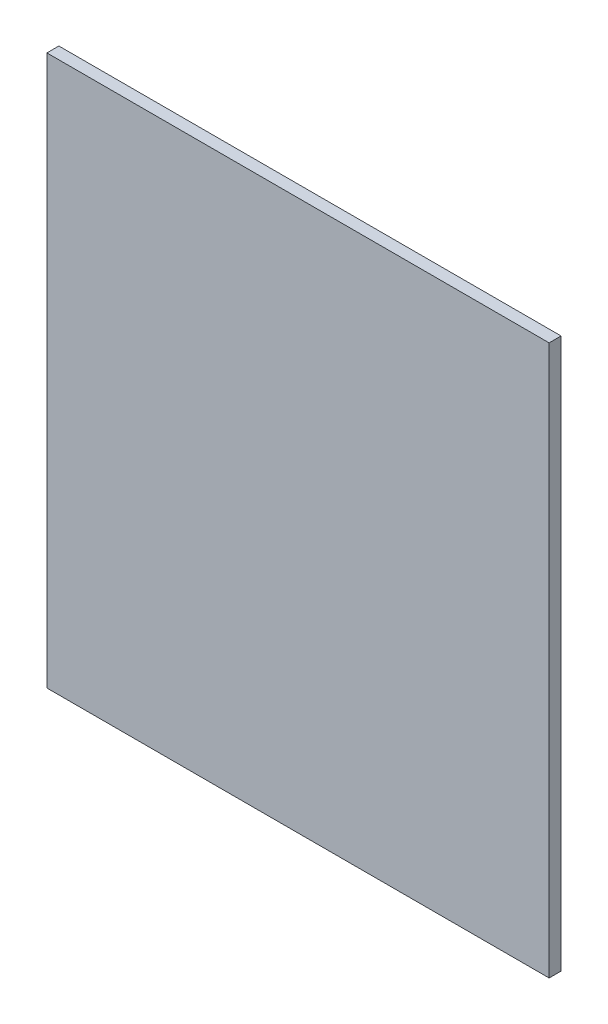
from build123d import *

# Parameters (mm, degrees)
SKETCH1_W           = 533.4
SKETCH1_H           = 584.2
BOSS_EXTRUDE1_DEPTH = 12.7


with BuildPart() as part:
    # Sketch1 → Boss-Extrude1 (new body)
    with BuildSketch(Plane.XY):
        with Locations((266.7, 292.1)):
            Rectangle(SKETCH1_W, SKETCH1_H)
    extrude(amount=BOSS_EXTRUDE1_DEPTH)


solid = part.part
